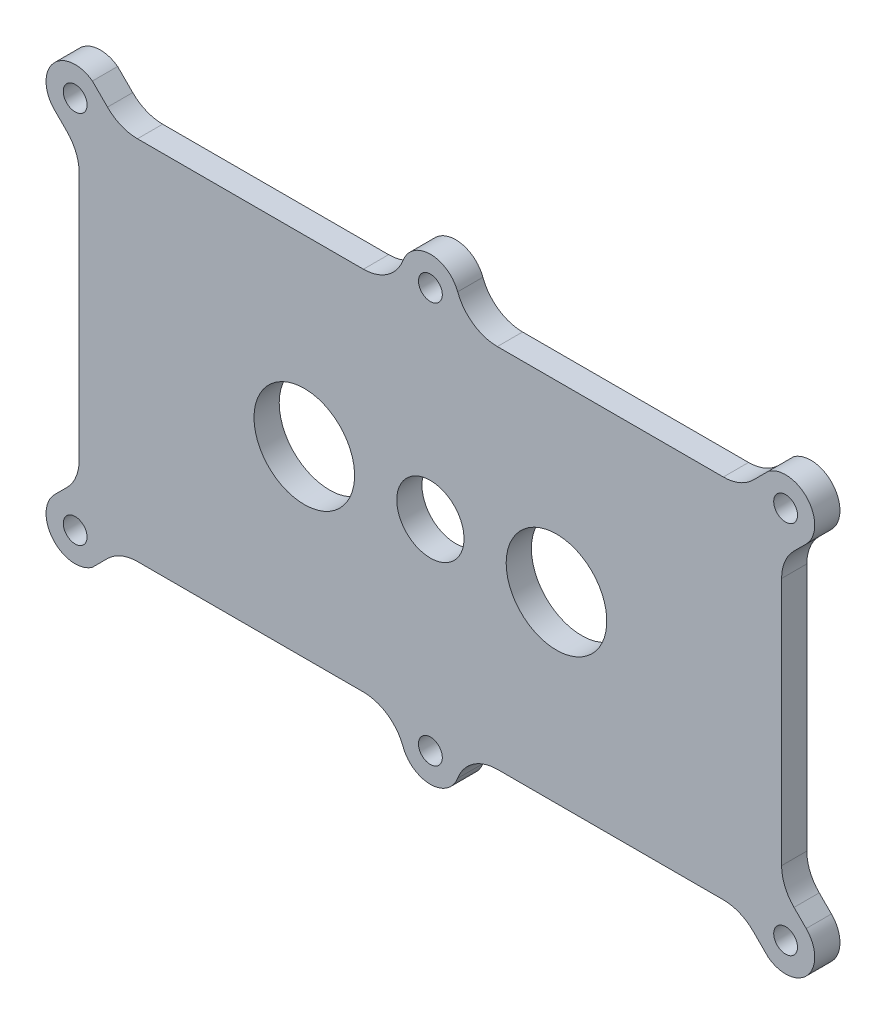
from build123d import *

# Parameters (mm, degrees)
BOSS_EXTRUDE1_DEPTH  = 4.7625
M4_CLEARANCE_HOLE1_D = 4.5
SKETCH4_R            = 6.35
SKETCH4_R_2          = 9.5
CUT_EXTRUDE1_DEPTH   = 85.681745462


with BuildPart() as part:
    # Sketch1 → Boss-Extrude1 (new body)
    with BuildSketch(Plane.XY):
        with BuildLine():
            ThreePointArc((68.668145751, 29.139971157), (66.93396374, 26.544584367), (66.325, 23.483116908))
            Line((66.325, 23.483116908), (66.325, -23.483116908))
            ThreePointArc((66.325, -23.483116908), (66.93396374, -26.544584367), (68.668145751, -29.139971157))
            Line((68.668145751, -29.139971157), (70.973014298, -31.444839705))
            ThreePointArc((70.973014298, -31.444839705), (71.257349949, -38.916180607), (63.829230118, -39.767542704))
            Line((63.829230118, -39.767542704), (60.979833165, -36.918145751))
            ThreePointArc((60.979833165, -36.918145751), (58.384446374, -35.18396374), (55.322978915, -34.575))
            Line((55.322978915, -34.575), (12.648995245, -34.575))
            ThreePointArc((12.648995245, -34.575), (8.086292992, -36.003717922), (5.153294359, -39.779562963))
            ThreePointArc((5.153294359, -39.779562963), (0, -43.3577), (-5.153294359, -39.779562963))
            ThreePointArc((-5.153294359, -39.779562963), (-8.086292992, -36.003717922), (-12.648995245, -34.575))
            Line((-12.648995245, -34.575), (-55.322978915, -34.575))
            ThreePointArc((-55.322978915, -34.575), (-58.384446374, -35.18396374), (-60.979833165, -36.918145751))
            Line((-60.979833165, -36.918145751), (-63.829230118, -39.767542704))
            ThreePointArc((-63.829230118, -39.767542704), (-71.257349949, -38.916180607), (-70.973014298, -31.444839705))
            Line((-70.973014298, -31.444839705), (-68.668145751, -29.139971157))
            ThreePointArc((-68.668145751, -29.139971157), (-66.93396374, -26.544584367), (-66.325, -23.483116908))
            Line((-66.325, -23.483116908), (-66.325, 23.483116908))
            ThreePointArc((-66.325, 23.483116908), (-66.93396374, 26.544584367), (-68.668145751, 29.139971157))
            Line((-68.668145751, 29.139971157), (-70.973014298, 31.444839705))
            ThreePointArc((-70.973014298, 31.444839705), (-71.257349949, 38.916180607), (-63.829230118, 39.767542704))
            Line((-63.829230118, 39.767542704), (-60.979833165, 36.918145751))
            ThreePointArc((-60.979833165, 36.918145751), (-58.384446374, 35.18396374), (-55.322978915, 34.575))
            Line((-55.322978915, 34.575), (-12.648995245, 34.575))
            ThreePointArc((-12.648995245, 34.575), (-8.086292992, 36.003717922), (-5.153294359, 39.779562963))
            ThreePointArc((-5.153294359, 39.779562963), (0, 43.3577), (5.153294359, 39.779562963))
            ThreePointArc((5.153294359, 39.779562963), (8.086292992, 36.003717922), (12.648995245, 34.575))
            Line((12.648995245, 34.575), (55.322978915, 34.575))
            ThreePointArc((55.322978915, 34.575), (58.384446374, 35.18396374), (60.979833165, 36.918145751))
            Line((60.979833165, 36.918145751), (63.829230118, 39.767542704))
            ThreePointArc((63.829230118, 39.767542704), (71.257349949, 38.916180607), (70.973014298, 31.444839705))
            Line((70.973014298, 31.444839705), (68.668145751, 29.139971157))
        make_face()
    extrude(amount=-BOSS_EXTRUDE1_DEPTH)

    # M4 Clearance Hole1 (through all)
    with Locations(Plane(origin=(0, 0, -4.7625), x_dir=(-1, 0, 0), z_dir=(0, 0, -1))):
        with Locations((-67.083927001, -35.333927001), (-67.083927001, 35.333927001), (0, 37.8577), (67.083927001, 35.333927001), (67.083927001, -35.333927001), (0, -37.8577)):
            Hole(M4_CLEARANCE_HOLE1_D / 2)

    # Sketch4 → Cut-Extrude1 (cut, through all)
    with BuildSketch(Plane(origin=(0, 0, -4.7625), x_dir=(-1, 0, 0), z_dir=(0, 0, -1))):
        Circle(SKETCH4_R)
        with Locations((-23.8125, 0)):
            Circle(SKETCH4_R_2)
        with Locations((23.8125, 0)):
            Circle(SKETCH4_R_2)
    extrude(amount=-CUT_EXTRUDE1_DEPTH, mode=Mode.SUBTRACT)


solid = part.part
